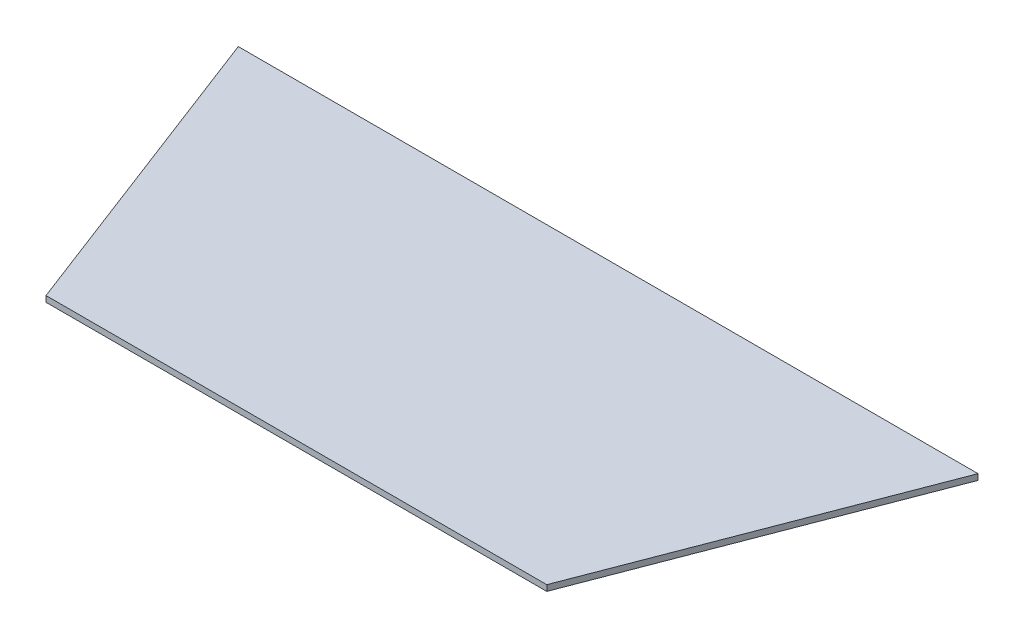
from build123d import *

# Parameters (mm, degrees)
BOSS_EXTRUDE1_DEPTH = 2


with BuildPart() as part:
    # Sketch1 → Boss-Extrude1 (new body)
    with BuildSketch(Plane(origin=(0, 0, 0), x_dir=(1, 0, 0), z_dir=(0, 1, 0))):
        Polygon((125.760920804, 106), (85.135, 0), (-85.135, 0), (-125.760920804, 106), align=None)
    extrude(amount=BOSS_EXTRUDE1_DEPTH)


solid = part.part
